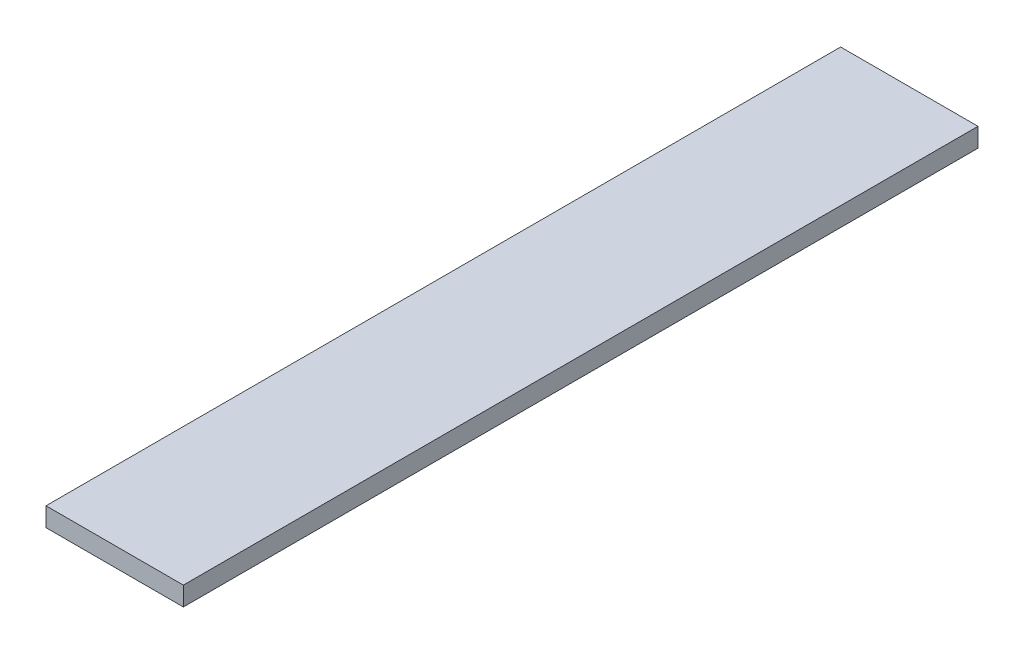
from build123d import *

# Parameters (mm, degrees)
SKETCH1_W           = 72.36
SKETCH1_H           = 418.62
BOSS_EXTRUDE1_DEPTH = 10


with BuildPart() as part:
    # Sketch1 → Boss-Extrude1 (new body)
    with BuildSketch(Plane(origin=(0, 0, 0), x_dir=(1, 0, 0), z_dir=(0, 1, 0))):
        Rectangle(SKETCH1_W, SKETCH1_H)
    extrude(amount=BOSS_EXTRUDE1_DEPTH)


solid = part.part
